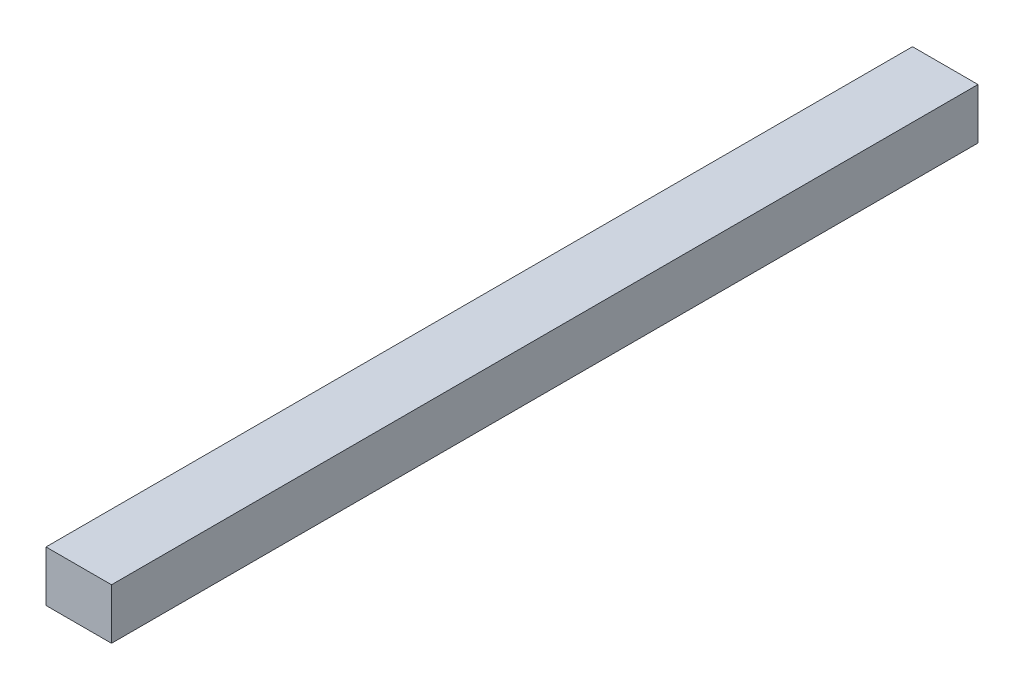
from build123d import *

# Parameters (mm, degrees)
SKETCH1_W           = 3.1
SKETCH1_H           = 2.4
BOSS_EXTRUDE1_DEPTH = 41


with BuildPart() as part:
    # Sketch1 → Boss-Extrude1 (new body)
    with BuildSketch(Plane.XY):
        Rectangle(SKETCH1_W, SKETCH1_H)
    extrude(amount=BOSS_EXTRUDE1_DEPTH)


solid = part.part
